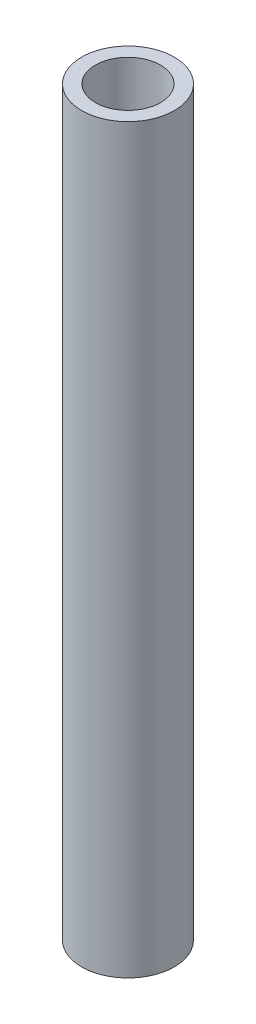
from build123d import *

# Parameters (mm, degrees)
SKETCH1_R           = 9.25
SKETCH1_R_2         = 6.5
BOSS_EXTRUDE1_DEPTH = 148


with BuildPart() as part:
    # Sketch1 → Boss-Extrude1 (new body)
    with BuildSketch(Plane(origin=(0, 0, 0), x_dir=(1, 0, 0), z_dir=(0, 1, 0))):
        with Locations(Location((0, 0, 0), (0, 0, 270))):
            Circle(SKETCH1_R)
        with Locations(Location((0, 0, 0), (0, 0, 270))):
            Circle(SKETCH1_R_2, mode=Mode.SUBTRACT)
    extrude(amount=BOSS_EXTRUDE1_DEPTH)


solid = part.part
